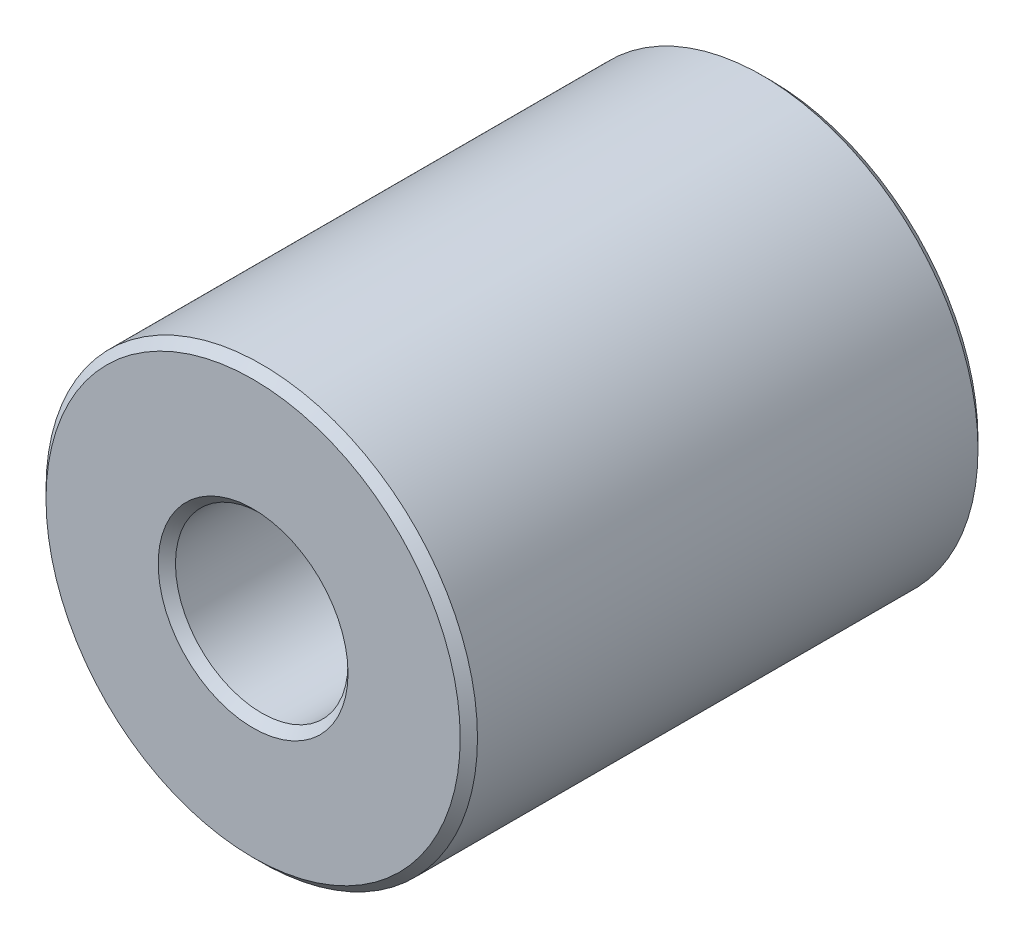
from build123d import *

# Parameters (mm, degrees)
IZIM1_R                     = 12.5
Y_KSEKLIK_EKSTR_ZYON1_DEPTH = 30
IZIM2_R                     = 5
KES_EKSTR_ZYON1_DEPTH       = 25
PAH1_SIZE                   = 0.5


with BuildPart() as part:
    # Çizim1 → Yükseklik-Ekstrüzyon1 (new body)
    with BuildSketch(Plane.XY):
        Circle(IZIM1_R)
    extrude(amount=Y_KSEKLIK_EKSTR_ZYON1_DEPTH)

    # Çizim2 → Kes-Ekstrüzyon1 (cut)
    with BuildSketch(Plane.XY.offset(30)):
        Circle(IZIM2_R)
    extrude(amount=-KES_EKSTR_ZYON1_DEPTH, mode=Mode.SUBTRACT)

    # Pah1
    pah1_edges = [part.edges().sort_by_distance(p)[0] for p in [
        (-12.5, 0, 0),
        (-12.5, 0, 30),
        (-5, 0, 30),
    ]]
    chamfer(pah1_edges, length=PAH1_SIZE)


solid = part.part
